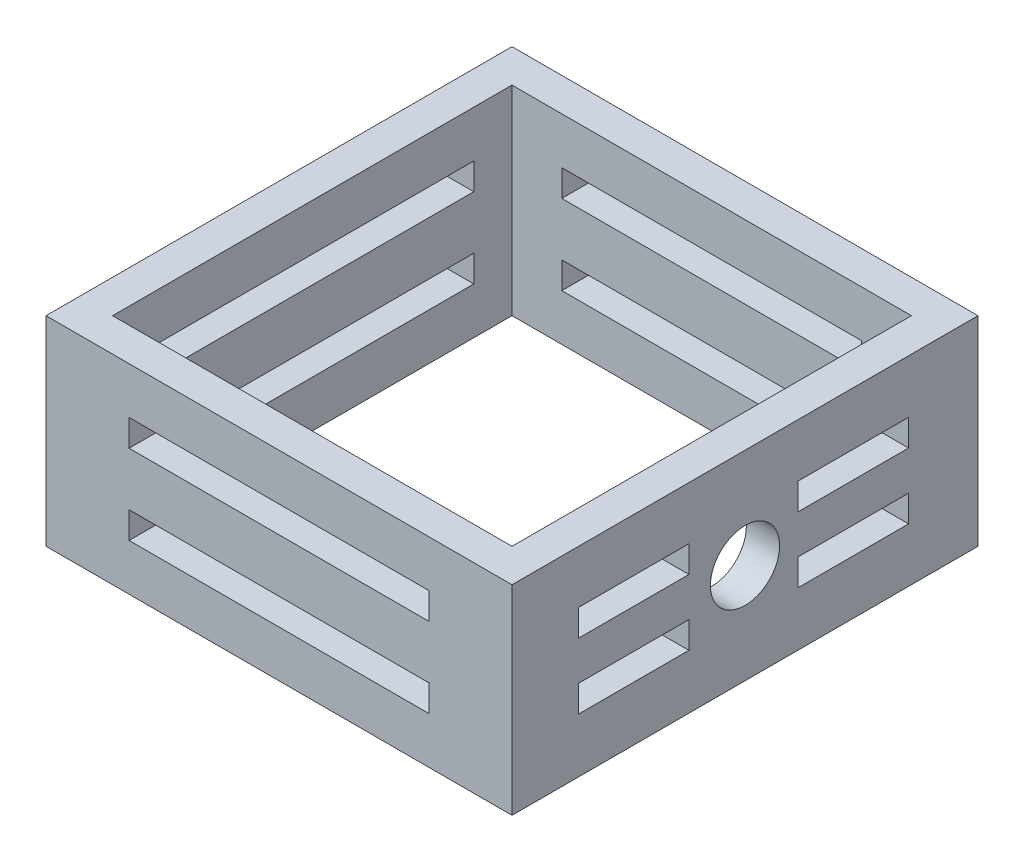
from build123d import *

# Parameters (mm, degrees)
SKETCH2_W           = 35
SKETCH2_H           = 35
BOSS_EXTRUDE1_DEPTH = 10
SKETCH3_W           = 35
SKETCH3_H           = 35
SKETCH3_W_2         = 30
SKETCH3_H_2         = 30
BOSS_EXTRUDE2_DEPTH = 15
SKETCH4_W           = 35
SKETCH4_H           = 35
BOSS_EXTRUDE3_DEPTH = 15
CUT_EXTRUDE1_START  = -40
SKETCH5_R           = 3.05
CUT_EXTRUDE1_DEPTH  = 40
SKETCH6_R           = 2.6
SKETCH6_W           = 8.296096318
SKETCH6_H           = 2.00000001
SKETCH6_H_2         = 2.000000011
CUT_EXTRUDE2_DEPTH  = 2.5
CUT_EXTRUDE3_REACH  = 48.435
SKETCH7_W           = 22.518110106
SKETCH7_H           = 2
SKETCH8_W           = 24.260657828
SKETCH8_H           = 2
CUT_EXTRUDE4_DEPTH  = 2.5


with BuildPart() as part:
    # Sketch2 → Boss-Extrude1 (new body)
    with BuildSketch(Plane(origin=(0, 0, 0), x_dir=(1, 0, 0), z_dir=(0, 1, 0))):
        Rectangle(SKETCH2_W, SKETCH2_H)
    extrude(amount=BOSS_EXTRUDE1_DEPTH)


with BuildPart() as body_2:
    # Sketch3 → Boss-Extrude2 (new body)
    with BuildSketch(Plane(origin=(0, 10, 0), x_dir=(1, 0, 0), z_dir=(0, 1, 0))):
        Rectangle(SKETCH3_W, SKETCH3_H)
        Rectangle(SKETCH3_W_2, SKETCH3_H_2, mode=Mode.SUBTRACT)
    extrude(amount=BOSS_EXTRUDE2_DEPTH)

    # Sketch6 → Cut-Extrude2 (cut)
    with BuildSketch(Plane(origin=(17.5, 0, 0), x_dir=(0, 0, -1), z_dir=(1, 0, 0))):
        with Locations((0, 17.5)):
            Circle(SKETCH6_R)
        with Locations((8.1389247, 15.064547851)):
            Rectangle(SKETCH6_W, SKETCH6_H)
        with Locations((8.1389247, 20.000000005)):
            Rectangle(SKETCH6_W, SKETCH6_H)
        with Locations((-8.361055595, 15.090047995)):
            Rectangle(SKETCH6_W, SKETCH6_H)
        with Locations((-8.361055595, 20.025500149)):
            Rectangle(SKETCH6_W, SKETCH6_H_2)
    extrude(amount=-CUT_EXTRUDE2_DEPTH, mode=Mode.SUBTRACT)

    # Cut-Extrude3: up to this face of the body (flat: up to its plane)
    cut_extrude3_end = Plane(body_2.part.faces().sort_by_distance((0, 17.5, -17.5))[0])
    # Sketch7 → Cut-Extrude3 (cut, up to the picked face)
    with BuildSketch(Plane.XY.offset(17.5), mode=Mode.PRIVATE) as cut_extrude3_sk1:
        with Locations((0, 20.5)):
            Rectangle(SKETCH7_W, SKETCH7_H)
    cut_extrude3_tool1 = split(extrude(cut_extrude3_sk1.sketch, amount=-CUT_EXTRUDE3_REACH, mode=Mode.PRIVATE), bisect_by=cut_extrude3_end, keep=Keep.BOTH, mode=Mode.PRIVATE)
    # Sketch7 → Cut-Extrude3 (cut, up to the picked face)
    with BuildSketch(Plane.XY.offset(17.5), mode=Mode.PRIVATE) as cut_extrude3_sk2:
        with Locations((0, 14.5)):
            Rectangle(SKETCH7_W, SKETCH7_H)
    cut_extrude3_tool2 = split(extrude(cut_extrude3_sk2.sketch, amount=-CUT_EXTRUDE3_REACH, mode=Mode.PRIVATE), bisect_by=cut_extrude3_end, keep=Keep.BOTH, mode=Mode.PRIVATE)
    add(cut_extrude3_tool1.solids().sort_by(Axis((0, 20.5, 17.5), (0, 0, -1)))[0], mode=Mode.SUBTRACT)
    add(cut_extrude3_tool2.solids().sort_by(Axis((0, 14.5, 17.5), (0, 0, -1)))[0], mode=Mode.SUBTRACT)

    # Sketch8 → Cut-Extrude4 (cut)
    with BuildSketch(Plane.ZY.offset(17.5)):
        with Locations((0, 20.5)):
            Rectangle(SKETCH8_W, SKETCH8_H)
        with Locations((0, 14.5)):
            Rectangle(SKETCH8_W, SKETCH8_H)
    extrude(amount=-CUT_EXTRUDE4_DEPTH, mode=Mode.SUBTRACT)


with BuildPart() as body_3:
    # Sketch4 → Boss-Extrude3 (new body)
    with BuildSketch(Plane(origin=(0, 25, 0), x_dir=(1, 0, 0), z_dir=(0, 1, 0))):
        Rectangle(SKETCH4_W, SKETCH4_H)
    extrude(amount=BOSS_EXTRUDE3_DEPTH)


with BuildPart() as cut_extrude1_tool:
    # Sketch5 → Cut-Extrude1 (new body)
    with BuildSketch(Plane(origin=(0, 40, 0), x_dir=(1, 0, 0), z_dir=(0, 1, 0)).offset(CUT_EXTRUDE1_START)):
        with Locations(Location((0, 0, 0), (0, 0, 270))):
            Circle(SKETCH5_R)
    extrude(amount=CUT_EXTRUDE1_DEPTH)


with BuildPart() as part_1:
    add(part.part)

    # Cut-Extrude1: cut by cut_extrude1_tool
    add(cut_extrude1_tool.part, mode=Mode.SUBTRACT)


with BuildPart() as body_3_1:
    add(body_3.part)

    # Cut-Extrude1: cut by cut_extrude1_tool
    add(cut_extrude1_tool.part, mode=Mode.SUBTRACT)


solid = body_2.part
